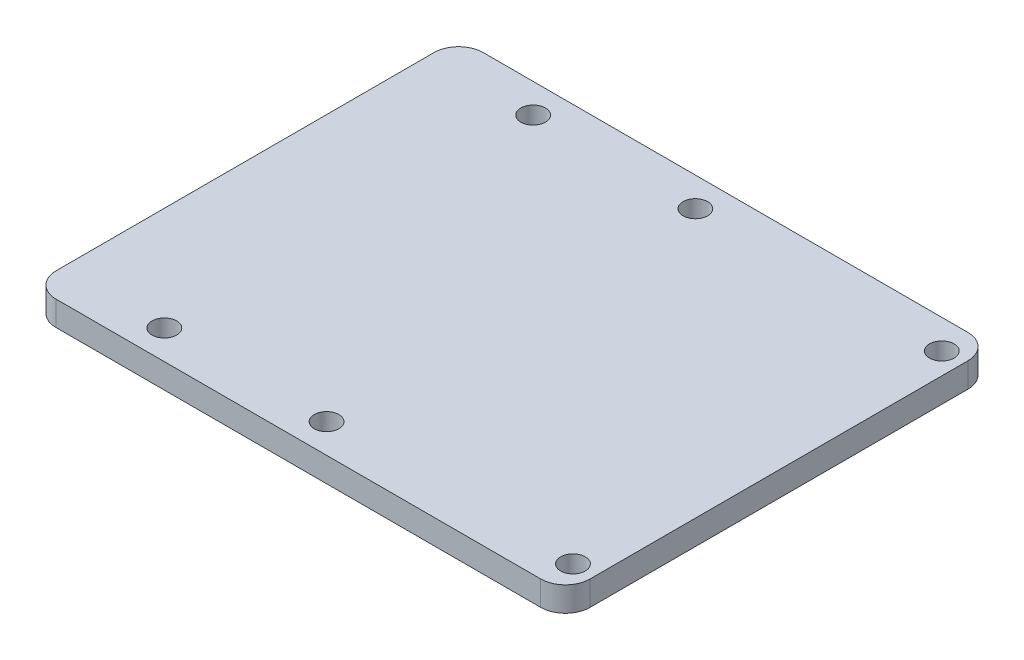
from build123d import *

# Parameters (mm, degrees)
SKETCH2_W           = 65
SKETCH2_H           = 52
SKETCH2_R           = 1.5
BOSS_EXTRUDE1_DEPTH = 3
FILLET1_R           = 3
CUT_EXTRUDE1_START  = -10
SKETCH3_R           = 1.5
CUT_EXTRUDE1_DEPTH  = 10


with BuildPart() as part:
    # Sketch2 → Boss-Extrude1 (new body)
    with BuildSketch(Plane(origin=(0, 0, 0), x_dir=(1, 0, 0), z_dir=(0, 1, 0))):
        with Locations((-5, 0)):
            Rectangle(SKETCH2_W, SKETCH2_H)
        with Locations(Location((-24.875, 22.45, 0), (0, 0, 270))):
            Circle(SKETCH2_R, mode=Mode.SUBTRACT)
        with Locations(Location((24.875, 22.45, 0), (0, 0, 270))):
            Circle(SKETCH2_R, mode=Mode.SUBTRACT)
        with Locations(Location((24.875, -22.45, 0), (0, 0, 270))):
            Circle(SKETCH2_R, mode=Mode.SUBTRACT)
        with Locations(Location((-24.875, -22.45, 0), (0, 0, 270))):
            Circle(SKETCH2_R, mode=Mode.SUBTRACT)
    extrude(amount=BOSS_EXTRUDE1_DEPTH)

    # Fillet1
    fillet1_edges = [part.edges().sort_by_distance(p)[0] for p in [
        (-37.5, 1.5, 26),
        (-37.5, 1.5, -26),
        (27.5, 1.5, -26),
        (27.5, 1.5, 26),
    ]]
    fillet(fillet1_edges, radius=FILLET1_R)

    # Sketch3 → Cut-Extrude1 (cut)
    with BuildSketch(Plane(origin=(0, 3, 0), x_dir=(1, 0, 0), z_dir=(0, 1, 0)).offset(CUT_EXTRUDE1_START)):
        with Locations(Location((24.875, 22.45, 0), (0, 0, 270))):
            Circle(SKETCH3_R)
        with Locations(Location((-5.125, 22.45, 0), (0, 0, 270))):
            Circle(SKETCH3_R)
        with Locations(Location((-5.125, -22.45, 0), (0, 0, 270))):
            Circle(SKETCH3_R)
        with Locations(Location((24.875, -22.45, 0), (0, 0, 270))):
            Circle(SKETCH3_R)
    extrude(amount=CUT_EXTRUDE1_DEPTH, mode=Mode.SUBTRACT)


solid = part.part
